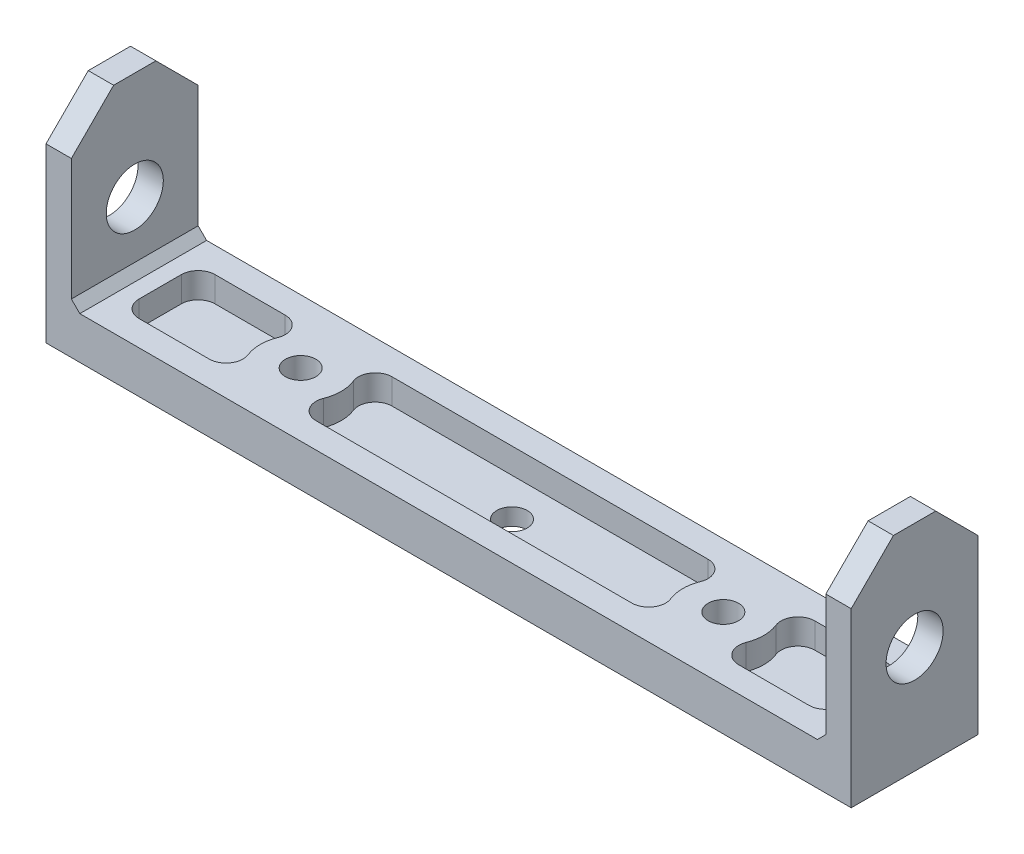
from build123d import *

# Parameters (mm, degrees)
SKETCH1_W                   = 95.25
SKETCH1_H                   = 15
BOSS_EXTRUDE1_DEPTH         = 5
SKETCH2_W                   = 3
SKETCH2_H                   = 25.4
BOSS_EXTRUDE2_DEPTH         = 15
F_1_4_CLEARANCE_HOLE1_D     = 6.7564
F_1_4_CLEARANCE_HOLE1_DEPTH = 12
F_1_4_CLEARANCE_HOLE1_TIP   = 2.029827343
M3_CLEARANCE_HOLE1_D        = 3.6
M3_CLEARANCE_HOLE1_DEPTH    = 12
M3_CLEARANCE_HOLE1_TIP      = 1.081549114
CUT_EXTRUDE1_START          = -3
SKETCH9_R                   = 1.8
CUT_EXTRUDE1_DEPTH          = 3
FILLET1_R                   = 2
CHAMFER1_SIZE               = 1
CHAMFER2_SIZE               = 5
SKETCH10_W                  = 79.639400705
SKETCH10_H                  = 33.458041781
CUT_EXTRUDE2_DEPTH          = 57.020537529


with BuildPart() as part:
    # Sketch1 → Boss-Extrude1 (new body)
    with BuildSketch(Plane(origin=(0, 0, 0), x_dir=(1, 0, 0), z_dir=(0, 1, 0))):
        Rectangle(SKETCH1_W, SKETCH1_H)
    extrude(amount=BOSS_EXTRUDE1_DEPTH)

    # Sketch2 → Boss-Extrude2 (add, through all)
    with BuildSketch(Plane.XY.offset(7.5)):
        with Locations((-46.125, 12.7)):
            Rectangle(SKETCH2_W, SKETCH2_H)
    extrude(amount=-BOSS_EXTRUDE2_DEPTH)

    # 1/4 Clearance Hole1
    with Locations(Plane(origin=(-44.625, 0, 0), x_dir=(0, 0, -1), z_dir=(1, 0, 0))):
        with Locations((0, 12.7)):
            Hole(F_1_4_CLEARANCE_HOLE1_D / 2, depth=F_1_4_CLEARANCE_HOLE1_DEPTH)
            with Locations((0, 0, -(F_1_4_CLEARANCE_HOLE1_DEPTH + F_1_4_CLEARANCE_HOLE1_TIP / 2))):  # 118° drill point
                Cone(0, F_1_4_CLEARANCE_HOLE1_D / 2, F_1_4_CLEARANCE_HOLE1_TIP, mode=Mode.SUBTRACT)

    # M3 Clearance Hole1
    with Locations(Plane(origin=(0, 5, 0), x_dir=(1, 0, 0), z_dir=(0, 1, 0))):
        with Locations((-25, 0), (0, 0)):
            Hole(M3_CLEARANCE_HOLE1_D / 2, depth=M3_CLEARANCE_HOLE1_DEPTH)
            with Locations((0, 0, -(M3_CLEARANCE_HOLE1_DEPTH + M3_CLEARANCE_HOLE1_TIP / 2))):  # 118° drill point
                Cone(0, M3_CLEARANCE_HOLE1_D / 2, M3_CLEARANCE_HOLE1_TIP, mode=Mode.SUBTRACT)

    # Sketch9 → Cut-Extrude1 (cut)
    # profile 1 of 2: a face of its own
    with BuildSketch(Plane(origin=(0, 5, 0), x_dir=(1, 0, 0), z_dir=(0, 1, 0)).offset(CUT_EXTRUDE1_START)):
        with BuildLine():
            ThreePointArc((-26.670329309, -4.5), (-29.8, 0), (-26.670329309, 4.5))
            Line((-26.670329309, 4.5), (-41.625, 4.5))
            Line((-41.625, 4.5), (-41.625, -4.5))
            Line((-41.625, -4.5), (-26.670329309, -4.5))
        make_face()
    # profile 2 of 2: a face of its own
    with BuildSketch(Plane(origin=(0, 5, 0), x_dir=(1, 0, 0), z_dir=(0, 1, 0)).offset(CUT_EXTRUDE1_START)):
        with BuildLine():
            Line((44.625, -4.5), (44.625, 4.5))
            Line((44.625, 4.5), (-23.329670691, 4.5))
            ThreePointArc((-23.329670691, 4.5), (-21.059341382, 2.740658618), (-20.2, 0))
            ThreePointArc((-20.2, 0), (-21.059341382, -2.740658618), (-23.329670691, -4.5))
            Line((-23.329670691, -4.5), (44.625, -4.5))
        make_face()
        with Locations(Location((0, 0, 0), (0, 0, 270))):
            Circle(SKETCH9_R, mode=Mode.SUBTRACT)
    extrude(amount=CUT_EXTRUDE1_DEPTH, mode=Mode.SUBTRACT)

    # Fillet1
    fillet1_edges = [part.edges().sort_by_distance(p)[0] for p in [
        (-26.670329309, 3.5, -4.5),
        (-26.670329309, 3.5, 4.5),
        (-41.625, 3.5, 4.5),
        (-41.625, 3.5, -4.5),
        (-23.329670691, 3.5, 4.5),
        (-23.329670691, 3.5, -4.5),
    ]]
    fillet(fillet1_edges, radius=FILLET1_R)

    # Chamfer1
    chamfer1_edges = [part.edges().sort_by_distance(p)[0] for p in [
        (-44.625, 5, 0),
    ]]
    chamfer(chamfer1_edges, length=CHAMFER1_SIZE)

    # Chamfer2
    chamfer2_edges = [part.edges().sort_by_distance(p)[0] for p in [
        (-46.125, 25.4, 7.5),
        (-46.125, 25.4, -7.5),
    ]]
    chamfer(chamfer2_edges, length=CHAMFER2_SIZE)

    # Sketch10 → Cut-Extrude2 (cut, through all)
    with BuildSketch(Plane.XY.offset(7.5)):
        with Locations((39.819700352, 16.72902089)):
            Rectangle(SKETCH10_W, SKETCH10_H)
    extrude(amount=-CUT_EXTRUDE2_DEPTH, mode=Mode.SUBTRACT)

    # Mirror2: part across plane


with BuildPart() as part_1:
    add(part.part)
    add(part.part.mirror(Plane(origin=(0, 0, 0), x_dir=(0, 0, 1), z_dir=(1, 0, 0))))


solid = part_1.part
